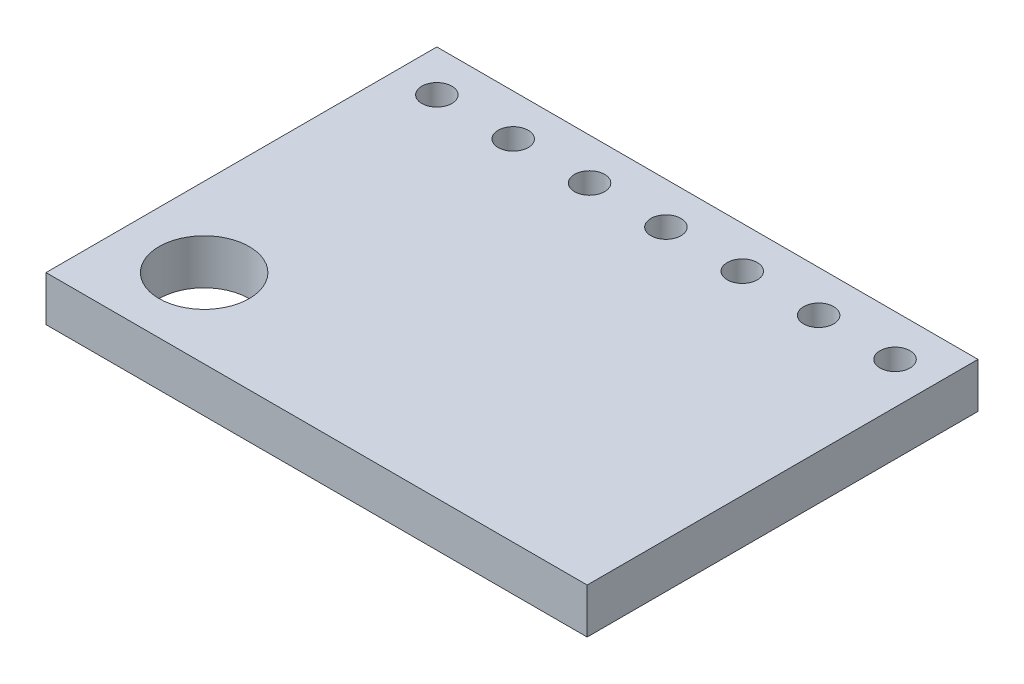
from build123d import *

# Parameters (mm, degrees)
SKETCH1_W           = 18
SKETCH1_H           = 13
SKETCH1_R           = 0.5
SKETCH1_R_2         = 1.5
BOSS_EXTRUDE1_DEPTH = 1.5


with BuildPart() as part:
    # Sketch1 → Boss-Extrude1 (new body)
    with BuildSketch(Plane(origin=(0, 0, 0), x_dir=(1, 0, 0), z_dir=(0, 1, 0))):
        with Locations((9, -6.5)):
            Rectangle(SKETCH1_W, SKETCH1_H)
        with Locations(Location((1.38, -1.38, 0), (0, 0, 270))):
            Circle(SKETCH1_R, mode=Mode.SUBTRACT)
        with Locations(Location((3.92, -1.38, 0), (0, 0, 270))):
            Circle(SKETCH1_R, mode=Mode.SUBTRACT)
        with Locations(Location((6.46, -1.38, 0), (0, 0, 270))):
            Circle(SKETCH1_R, mode=Mode.SUBTRACT)
        with Locations(Location((9, -1.38, 0), (0, 0, 270))):
            Circle(SKETCH1_R, mode=Mode.SUBTRACT)
        with Locations(Location((11.54, -1.38, 0), (0, 0, 270))):
            Circle(SKETCH1_R, mode=Mode.SUBTRACT)
        with Locations(Location((14.08, -1.38, 0), (0, 0, 270))):
            Circle(SKETCH1_R, mode=Mode.SUBTRACT)
        with Locations(Location((16.62, -1.38, 0), (0, 0, 270))):
            Circle(SKETCH1_R, mode=Mode.SUBTRACT)
        with Locations(Location((2.63, -10.37, 0), (0, 0, 270))):
            Circle(SKETCH1_R_2, mode=Mode.SUBTRACT)
    extrude(amount=-BOSS_EXTRUDE1_DEPTH)


solid = part.part
